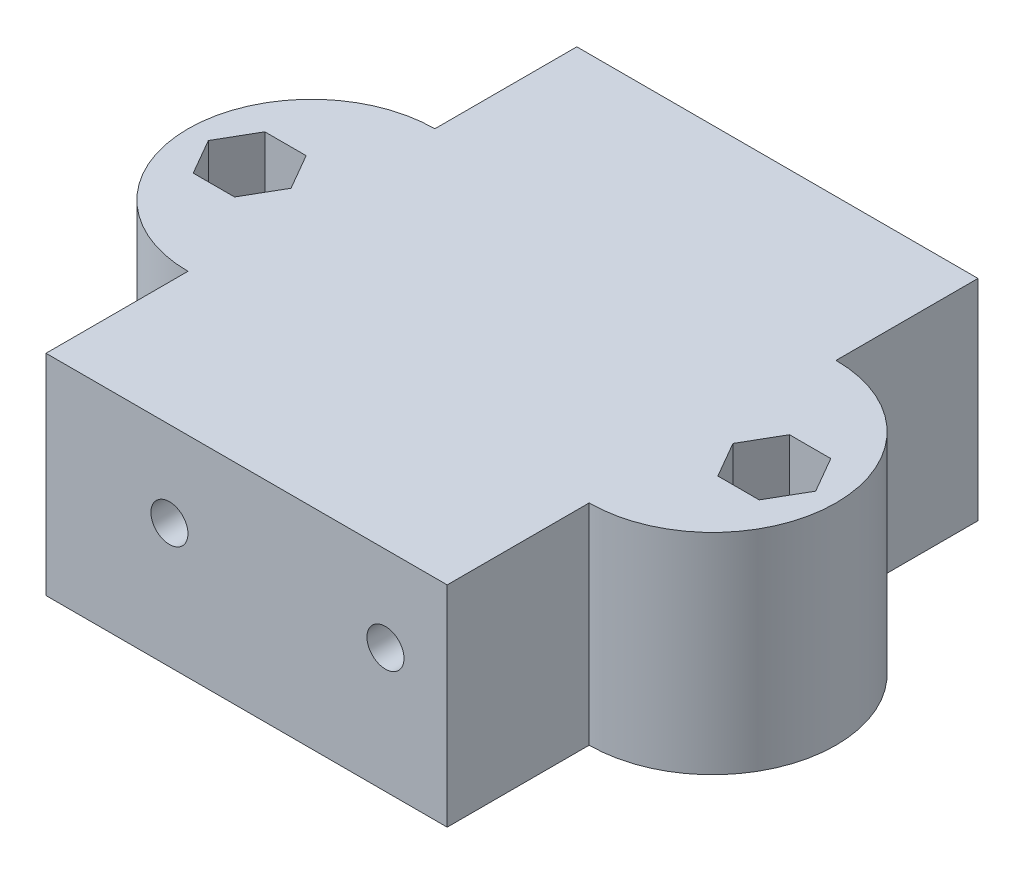
from build123d import *

# Parameters (mm, degrees)
ESQUISSE1_W         = 32.5
ESQUISSE1_H         = 43
ESQUISSE1_R         = 11.9
BOSS_EXTRU_1_DEPTH  = 12
SKETCH2_W           = 32.5
SKETCH2_H           = 43
BOSS_EXTRUDE1_DEPTH = 5
SKETCH3_R           = 1.5
CUT_EXTRUDE2_DEPTH  = 10
BOSS_EXTRUDE2_DEPTH = 17
SKETCH5_R           = 1.75
CUT_EXTRUDE3_DEPTH  = 48.797930062
SKETCH5_3_R         = 1.75
CUT_EXTRUDE4_DEPTH  = 10


with BuildPart() as part:
    # Esquisse1 → Boss.-Extru.1 (new body)
    with BuildSketch(Plane(origin=(0, 0, 0), x_dir=(1, 0, 0), z_dir=(0, 1, 0))):
        with Locations((0, -14.646640483)):
            Rectangle(ESQUISSE1_W, ESQUISSE1_H)
        with Locations(Location((0, -14.646640483, 0), (0, 0, 270))):
            Circle(ESQUISSE1_R, mode=Mode.SUBTRACT)
    extrude(amount=BOSS_EXTRU_1_DEPTH)

    # Sketch2 → Boss-Extrude1 (add)
    with BuildSketch(Plane(origin=(0, 12, 0), x_dir=(1, 0, 0), z_dir=(0, 1, 0))):
        with Locations((0, -14.646640483)):
            Rectangle(SKETCH2_W, SKETCH2_H)
    extrude(amount=BOSS_EXTRUDE1_DEPTH)

    # Sketch3 → Cut-Extrude2 (cut)
    with BuildSketch(Plane.XY.offset(36.146640483)):
        with Locations((11.25, 10.086854916)):
            Circle(SKETCH3_R)
        with Locations((-6.25, 10.086854916)):
            Circle(SKETCH3_R)
    cut_extrude2 = extrude(amount=-CUT_EXTRUDE2_DEPTH, mode=Mode.SUBTRACT)

    # Mirror1: Cut-Extrude2 across plane
    add(cut_extrude2.mirror(Plane.XY.offset(14.646640483)), mode=Mode.SUBTRACT)

    # Sketch4 → Boss-Extrude2 (add)
    with BuildSketch(Plane(origin=(0, 17, 0), x_dir=(1, 0, 0), z_dir=(0, 1, 0))):
        with BuildLine():
            Line((16.25, -4.646640483), (16.25, -24.646640483))
            ThreePointArc((16.25, -24.646640483), (26.25, -14.646640483), (16.25, -4.646640483))
        make_face()
        with BuildLine():
            Line((-16.25, -4.646640483), (-16.25, -24.646640483))
            ThreePointArc((-16.25, -24.646640483), (-26.25, -14.646640483), (-16.25, -4.646640483))
        make_face()
    extrude(amount=-BOSS_EXTRUDE2_DEPTH)

    # Sketch5 → Cut-Extrude3 (cut, through all)
    with BuildSketch(Plane(origin=(0, 17, 0), x_dir=(1, 0, 0), z_dir=(0, 1, 0))):
        with Locations(Location((-21.25, -14.646640483, 0), (0, 0, 270))):
            Circle(SKETCH5_R)
        with Locations(Location((21.25, -14.646640483, 0), (0, 0, 270))):
            Circle(SKETCH5_R)
    extrude(amount=-CUT_EXTRUDE3_DEPTH, mode=Mode.SUBTRACT)

    # Sketch5<3> → Cut-Extrude4 (cut)
    # profile 1 of 2: a face of its own
    with BuildSketch(Plane(origin=(0, 17, 0), x_dir=(1, 0, 0), z_dir=(0, 1, 0))):
        Polygon((22.924315781, -17.546640483), (24.598631561, -14.646640483), (22.924315781, -11.746640483), (19.575684219, -11.746640483), (17.901368439, -14.646640483), (19.575684219, -17.546640483), align=None)
        with Locations(Location((21.25, -14.646640483, 0), (0, 0, 270))):
            Circle(SKETCH5_3_R, mode=Mode.SUBTRACT)
    # profile 2 of 2: a face of its own
    with BuildSketch(Plane(origin=(0, 17, 0), x_dir=(1, 0, 0), z_dir=(0, 1, 0))):
        Polygon((-19.575684219, -17.546640483), (-22.924315781, -17.546640483), (-24.598631561, -14.646640483), (-22.924315781, -11.746640483), (-19.575684219, -11.746640483), (-17.901368439, -14.646640483), align=None)
        with Locations(Location((-21.25, -14.646640483, 0), (0, 0, 270))):
            Circle(SKETCH5_3_R, mode=Mode.SUBTRACT)
    extrude(amount=-CUT_EXTRUDE4_DEPTH, mode=Mode.SUBTRACT)


solid = part.part
